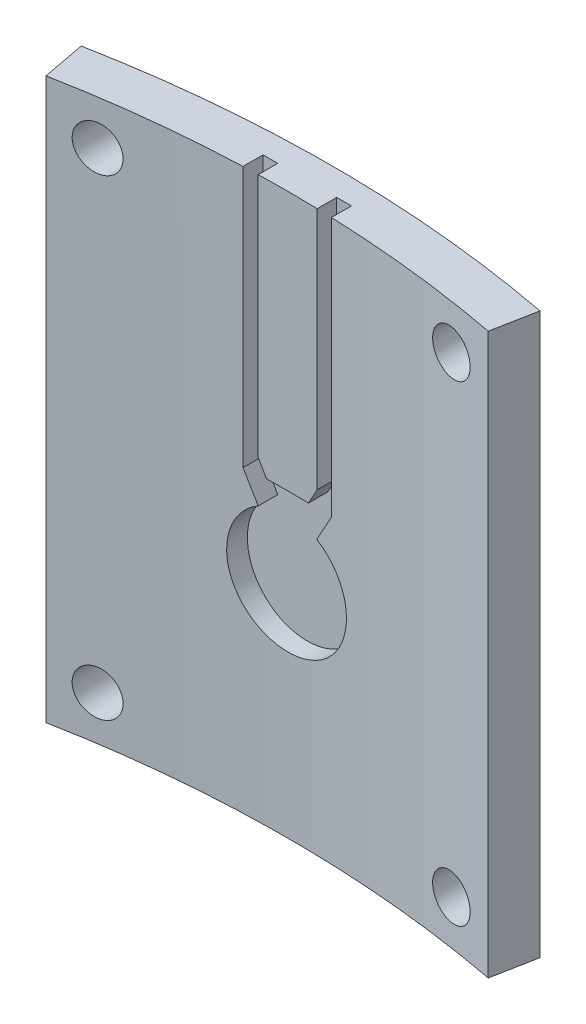
from build123d import *

# Parameters (mm, degrees)
BOSS_EXTRUDE1_DEPTH = 48.26
CUT_EXTRUDE1_DEPTH  = 103.251
SKETCH3_R           = 1.905
CUT_EXTRUDE2_DEPTH  = 118.604958351


with BuildPart() as part:
    # Sketch1 → Boss-Extrude1 (new body)
    with BuildSketch(Plane(origin=(0, 0, 0), x_dir=(1, 0, 0), z_dir=(0, 1, 0))):
        with BuildLine():
            Line((-19.05, 99.798083649), (-19.764375, 103.540511786))
            ThreePointArc((-19.764375, 103.540511786), (0, 105.41), (19.764375, 103.540511786))
            Line((19.764375, 103.540511786), (19.05, 99.798083649))
            ThreePointArc((19.05, 99.798083649), (0, 101.6), (-19.05, 99.798083649))
        make_face()
    extrude(amount=BOSS_EXTRUDE1_DEPTH)

    # Sketch2 → Cut-Extrude1 (cut)
    with BuildSketch(Plane.XY):
        with BuildLine():
            Line((-2.54, 23.540829588), (-3.81, 25.786244382))
            Line((-3.81, 25.786244382), (-3.81, 48.26))
            Line((-3.81, 48.26), (-2.54, 48.26))
            Line((-2.54, 48.26), (-2.54, 27.152392088))
            Line((-2.54, 27.152392088), (-1.836175497, 25.908))
            Line((-1.836175497, 25.908), (1.776041068, 25.908))
            Line((1.776041068, 25.908), (2.54, 27.283126078))
            Line((2.54, 27.283126078), (2.54, 48.26))
            Line((2.54, 48.26), (3.81, 48.26))
            Line((3.81, 48.26), (3.81, 25.908))
            Line((3.81, 25.908), (2.505613998, 23.560105196))
            ThreePointArc((2.505613998, 23.560105196), (0.019710062, 13.890662649), (-2.54, 23.540829588))
        make_face()
    extrude(amount=-CUT_EXTRUDE1_DEPTH, mode=Mode.SUBTRACT)

    # Sketch3 → Cut-Extrude2 (cut, through all)
    with BuildSketch(Plane.XY):
        with Locations((-15.24, 44.45)):
            Circle(SKETCH3_R)
        with Locations((15.24, 44.45)):
            Circle(SKETCH3_R)
        with Locations((-15.24, 3.81)):
            Circle(SKETCH3_R)
        with Locations((15.24, 3.81)):
            Circle(SKETCH3_R)
    extrude(amount=-CUT_EXTRUDE2_DEPTH, mode=Mode.SUBTRACT)


solid = part.part
